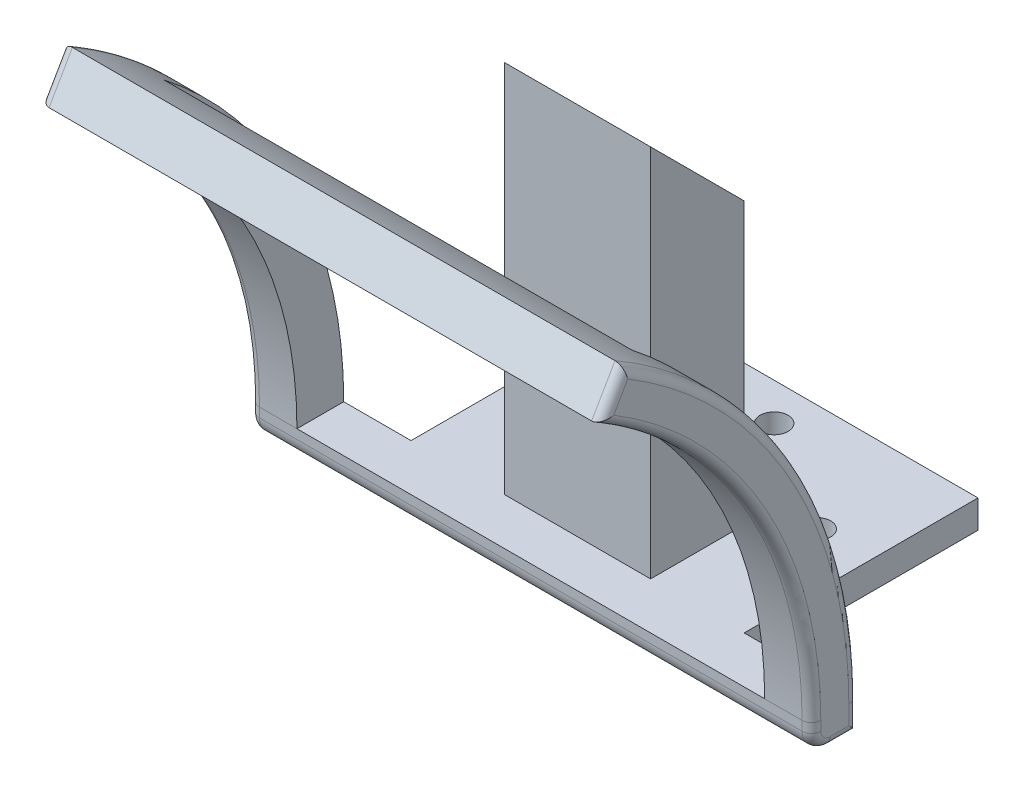
from build123d import *

# Parameters (mm, degrees)
SKETCH1_W           = 17.805
SKETCH1_H           = 25
BOSS_EXTRUDE1_DEPTH = 3
FILLET1_R           = 2
BOSS_EXTRUDE3_DEPTH = 5
SKETCH3_R           = 1.5
CUT_EXTRUDE1_DEPTH  = 5
SKETCH7_W           = 15.61
SKETCH7_H           = 10
BOSS_EXTRUDE4_DEPTH = 30
BOSS_EXTRUDE5_DEPTH = 15.61
SKETCH9_R           = 1.5
CUT_EXTRUDE2_DEPTH  = 5
BOSS_EXTRUDE6_DEPTH = 50
FILLET2_R           = 1


with BuildPart() as part:
    # Sketch1 → Boss-Extrude1 (new body)
    with BuildSketch(Plane(origin=(0, 0, 0), x_dir=(1, 0, 0), z_dir=(0, 1, 0))):
        Polygon((9.368218391, -4.75), (-8.436781609, -4.75), (-26.241781609, -4.75), (-38.436781609, -4.75), (-38.436781609, -9.75), (21.563218391, -9.75), (21.563218391, -4.75), align=None)
        with Locations((0.465718391, 7.75)):
            Rectangle(SKETCH1_W, SKETCH1_H)
        with Locations((-17.339281609, 7.75)):
            Rectangle(SKETCH1_W, SKETCH1_H)
    extrude(amount=BOSS_EXTRUDE1_DEPTH)

    # Fillet1
    fillet1_edges = [part.edges().sort_by_distance(p)[0] for p in [
        (-8.436781609, 0, 9.75),
    ]]
    fillet(fillet1_edges, radius=FILLET1_R)

    # Sketch2 → Boss-Extrude3 (add)
    with BuildSketch(Plane(origin=(21.563218391, 0, 0), x_dir=(0, 0, -1), z_dir=(1, 0, 0))):
        with BuildLine():
            Line((-29.75, 46.301270189), (-32.25, 41.97114317))
            ThreePointArc((-32.25, 41.97114317), (-15.77885683, 25.5), (-9.75, 3))
            Line((-9.75, 3), (-4.75, 3))
            ThreePointArc((-4.75, 3), (-11.448729811, 28), (-29.75, 46.301270189))
        make_face()
    boss_extrude3 = extrude(amount=-BOSS_EXTRUDE3_DEPTH)

    # Mirror3: Boss-Extrude3 across plane
    add(boss_extrude3.mirror(Plane(origin=(-8.436781609, 0, 0), x_dir=(0, 0, 1), z_dir=(1, 0, 0))))

    # Sketch3 → Cut-Extrude1 (cut)
    with BuildSketch(Plane.XZ):
        with Locations(Location((-20.484687418, -8.75, 0), (0, 0, 270))):
            Circle(SKETCH3_R)
        with Locations(Location((-8.434877213, -16.25, 0), (0, 0, 270))):
            Circle(SKETCH3_R)
        with Locations(Location((3.614932992, -8.75, 0), (0, 0, 270))):
            Circle(SKETCH3_R)
    extrude(amount=-CUT_EXTRUDE1_DEPTH, mode=Mode.SUBTRACT)

    # Sketch7 → Boss-Extrude4 (add)
    with BuildSketch(Plane(origin=(0, 3, 0), x_dir=(1, 0, 0), z_dir=(0, 1, 0))):
        with Locations((-8.436781609, 0.25)):
            Rectangle(SKETCH7_W, SKETCH7_H)
    extrude(amount=BOSS_EXTRUDE4_DEPTH)

    # Sketch8 → Boss-Extrude5 (add)
    with BuildSketch(Plane.ZY.offset(16.241781609)):
        Polygon((-5.25, 33), (4.75, 43), (4.75, 33), align=None)
    extrude(amount=-BOSS_EXTRUDE5_DEPTH)

    # Sketch9 → Cut-Extrude2 (cut)
    with BuildSketch(Plane(origin=(0, 19.125, -19.125), x_dir=(1, 0, 0), z_dir=(0, 0.7071067811865461, -0.7071067811865489))):
        with Locations(Location((-11.436781609, -26.69328099, 0), (0, 0, 270))):
            Circle(SKETCH9_R)
        with Locations(Location((-5.436781609, -26.69328099, 0), (0, 0, 270))):
            Circle(SKETCH9_R)
    extrude(amount=-CUT_EXTRUDE2_DEPTH, mode=Mode.SUBTRACT)

    # Sketch10 → Boss-Extrude6 (add)
    with BuildSketch(Plane(origin=(-33.436781609, 0, 0), x_dir=(0, 0, -1), z_dir=(1, 0, 0))):
        with BuildLine():
            Line((-27.04523361, 38.460483912), (-23.966926234, 42.40053768))
            ThreePointArc((-23.966926234, 42.40053768), (-26.790354826, 44.451878628), (-29.75, 46.301270189))
            Line((-29.75, 46.301270189), (-32.25, 41.97114317))
            ThreePointArc((-32.25, 41.97114317), (-29.586319344, 40.306690765), (-27.04523361, 38.460483912))
        make_face()
    extrude(amount=BOSS_EXTRUDE6_DEPTH)

    # Fillet2
    fillet2_edges = [part.edges().sort_by_distance(p)[0] for p in [
        (-38.436781609, 0, 6.25),
        (21.563218391, 0, 6.25),
        (21.563218391, 2.5, 9.75),
        (-38.436781609, 2.5, 9.75),
        (-38.436781609, 1.5, 4.75),
        (21.563218391, 1.5, 4.75),
        (21.563218391, 0.585786438, 9.164213562),
        (-38.436781609, 0.585786438, 9.164213562),
        (21.563218391, 25.5, 15.77885683),
        (21.563218391, 28, 11.448729811),
        (21.563218391, 44.13620668, 31),
        (-38.436781609, 25.5, 15.77885683),
        (-38.436781609, 28, 11.448729811),
        (-38.436781609, 44.13620668, 31),
    ]]
    fillet(fillet2_edges, radius=FILLET2_R)


solid = part.part
